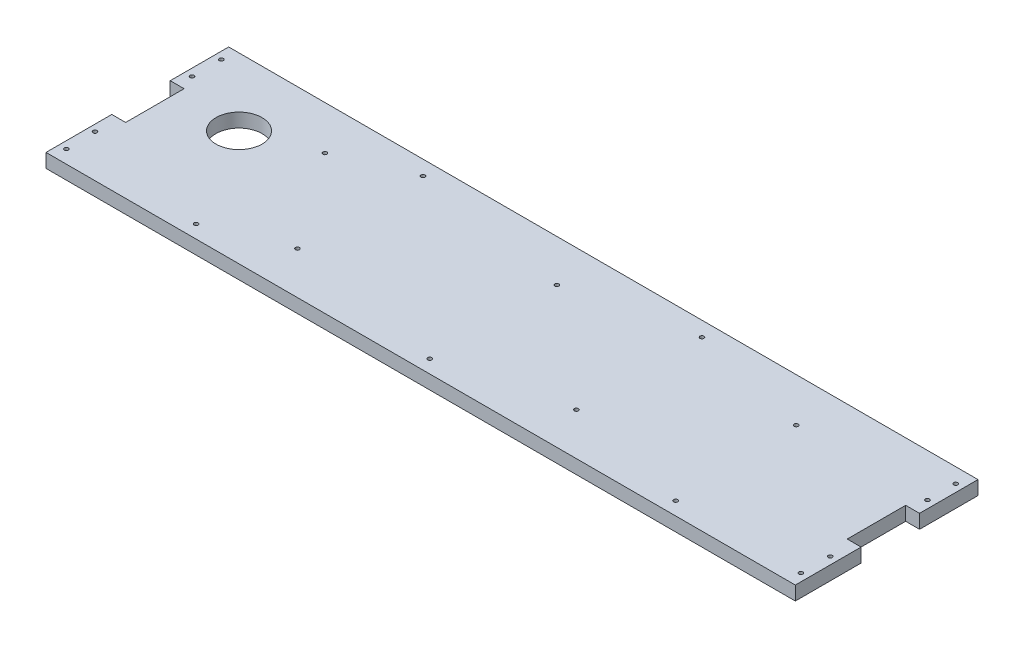
from build123d import *

# Parameters (mm, degrees)
SKETCH1_W                = 1025.461280364
SKETCH1_H                = 19
BOSS_EXTRUDE1_DEPTH      = 250
SKETCH2_R                = 31.474645295
CUT_EXTRUDE1_DEPTH       = 19
SKETCH3_W                = 80
SKETCH3_H                = 19
CUT_EXTRUDE2_DEPTH       = 19
SKETCH4_W                = 80
SKETCH4_H                = 19
CUT_EXTRUDE3_DEPTH       = 19
M5_CLEARANCE_HOLE2_D     = 5.5
M5_CLEARANCE_HOLE2_DEPTH = 19
M5_CLEARANCE_HOLE2_TIP   = 1.652366702


with BuildPart() as part:
    # Sketch1 → Boss-Extrude1 (new body)
    with BuildSketch(Plane.XY):
        with Locations((-1353.189241506, 552.74355083)):
            Rectangle(SKETCH1_W, SKETCH1_H)
    extrude(amount=BOSS_EXTRUDE1_DEPTH)

    # Sketch2 → Cut-Extrude1 (cut)
    with BuildSketch(Plane.XZ.offset(-543.24355083)):
        with Locations((-1759.414463941, 92.370881147)):
            Circle(SKETCH2_R)
    extrude(amount=-CUT_EXTRUDE1_DEPTH, mode=Mode.SUBTRACT)

    # Sketch3 → Cut-Extrude2 (cut)
    with BuildSketch(Plane(origin=(-840.458601324, 0, 0), x_dir=(0, 0, -1), z_dir=(1, 0, 0))):
        with Locations((-120, 552.74355083)):
            Rectangle(SKETCH3_W, SKETCH3_H)
    extrude(amount=-CUT_EXTRUDE2_DEPTH, mode=Mode.SUBTRACT)

    # Sketch4 → Cut-Extrude3 (cut)
    with BuildSketch(Plane.ZY.offset(1865.919881688)):
        with Locations((120, 552.74355083)):
            Rectangle(SKETCH4_W, SKETCH4_H)
    extrude(amount=-CUT_EXTRUDE3_DEPTH, mode=Mode.SUBTRACT)

    # M5 Clearance Hole2
    with Locations(Plane(origin=(-850.780626104, 562.24355083, 20.3), x_dir=(0, 0, 1), z_dir=(0, 1, 0))):
        with Locations((0, 0), (39.7, -178.583190579), (-0.102610802, -347.214178794), (37.25, -508.419165524), (-0.215464176, -729.087144166), (171.700000001, -729.087144166), (171.700000001, -347.214178794), (211.700000001, -171.536855259), (211.700000001, -0.124443922), (211.700000001, -507.967423392), (211.700000001, -827.650747254), (211.700000001, -1005.250659284), (-0.297077663, -1005.250659284), (39.7, -1005.250659284), (38.556814399, 0), (39.7, -823.444523141), (171.625882032, -1006.171227911), (171.900966052, 0.344520361)):
            Hole(M5_CLEARANCE_HOLE2_D / 2, depth=M5_CLEARANCE_HOLE2_DEPTH)
            with Locations((0, 0, -(M5_CLEARANCE_HOLE2_DEPTH + M5_CLEARANCE_HOLE2_TIP / 2))):  # 118° drill point
                Cone(0, M5_CLEARANCE_HOLE2_D / 2, M5_CLEARANCE_HOLE2_TIP, mode=Mode.SUBTRACT)


solid = part.part
